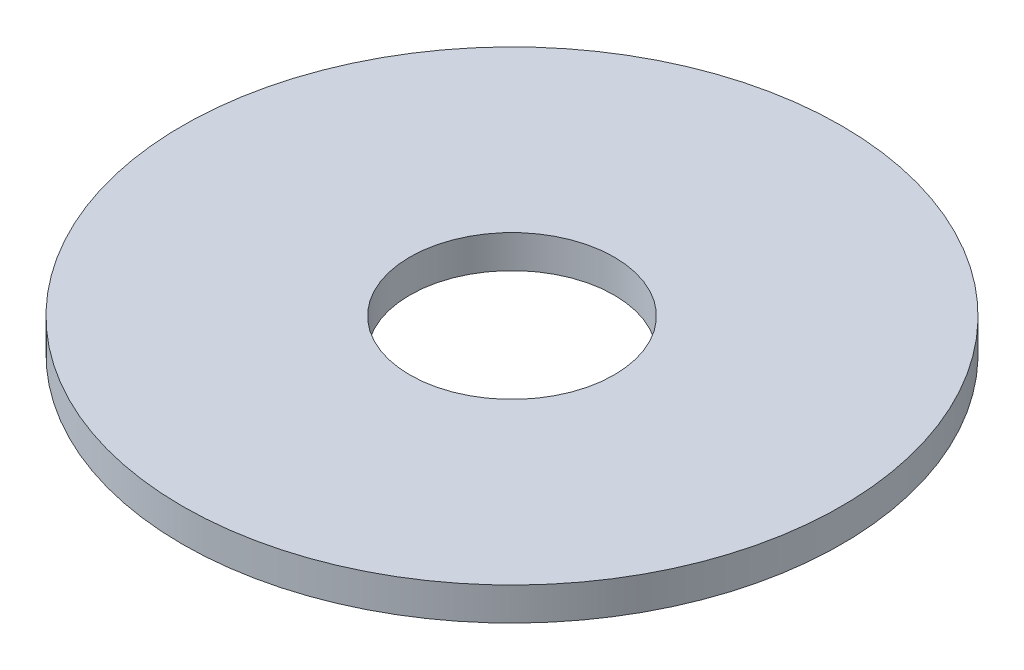
from build123d import *

# Parameters (mm, degrees)
SKETCH1_R           = 10
SKETCH1_R_2         = 3.1
BOSS_EXTRUDE1_DEPTH = 1


with BuildPart() as part:
    # Sketch1 → Boss-Extrude1 (new body)
    with BuildSketch(Plane(origin=(0, 0, 0), x_dir=(1, 0, 0), z_dir=(0, 1, 0))):
        with Locations(Location((0, 0, 0), (0, 0, 270))):
            Circle(SKETCH1_R)
        with Locations(Location((0, 0, 0), (0, 0, 270))):
            Circle(SKETCH1_R_2, mode=Mode.SUBTRACT)
    extrude(amount=BOSS_EXTRUDE1_DEPTH)


solid = part.part
